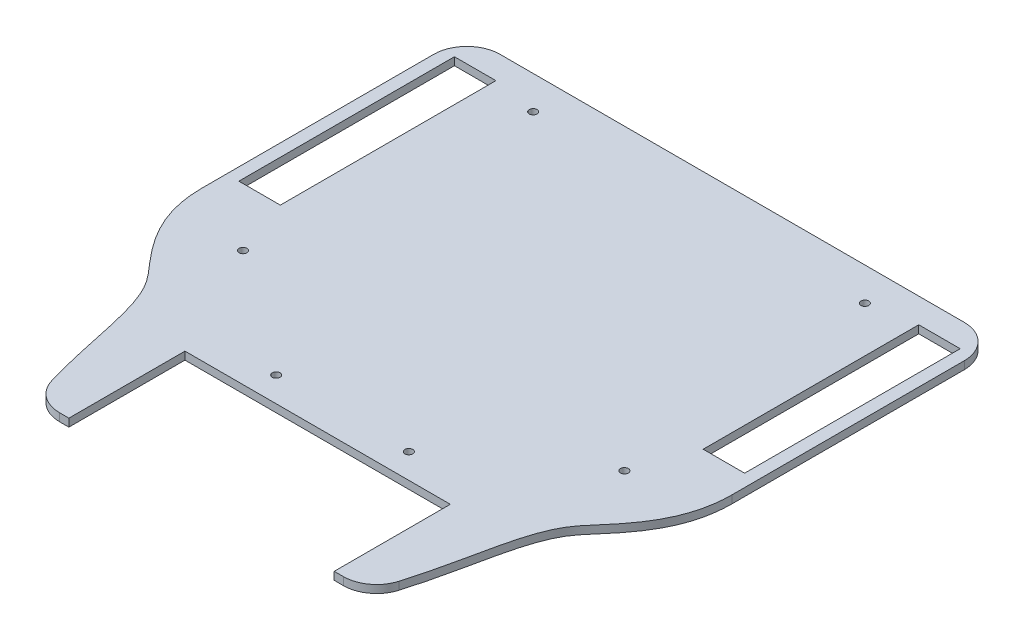
from build123d import *

# Parameters (mm, degrees)
BOSS_EXTRUDE1_DEPTH = 1.5
SKETCH3_R           = 1.5
SKETCH3_W           = 15.875
SKETCH3_H           = 82.55
CUT_EXTRUDE1_DEPTH  = 144.715413374
FILLET1_R           = 12.7


with BuildPart() as part:
    # Sketch1 → Boss-Extrude1 (new, symmetric)
    with BuildSketch(Plane(origin=(0, 0, 0), x_dir=(1, 0, 0), z_dir=(0, 1, 0))):
        with BuildLine():
            Line((-101.6, 0), (-101.6, 101.6))
            Line((-101.6, 101.6), (101.6, 101.6))
            Line((101.6, 101.6), (101.6, 0))
            add(Edge.make_bspline(
                [(101.6, 0), (101.6, -15.24), (92.836364207, -28.257655975), (72.917051275, -49.879895788), (72.621677222, -76.538397804), (63.5, -101.6)],
                knots=[0, 0, 0, 0, 0.415380003, 0.515380003, 1, 1, 1, 1], degree=3))
            Line((63.5, -101.6), (50.8, -101.6))
            Line((50.8, -101.6), (50.8, -57.15))
            Line((50.8, -57.15), (-50.8, -57.15))
            Line((-50.8, -57.15), (-50.8, -101.6))
            Line((-50.8, -101.6), (-63.5, -101.6))
            add(Edge.make_bspline(
                [(-101.6, 0), (-101.6, -15.24), (-92.836364207, -28.257655975), (-72.917051275, -49.879895788), (-72.621677222, -76.538397804), (-63.5, -101.6)],
                knots=[0, 0, 0, 0, 0.415380003, 0.515380003, 1, 1, 1, 1], degree=3))
        make_face()
    extrude(amount=BOSS_EXTRUDE1_DEPTH, both=True)

    # Sketch3 → Cut-Extrude1 (cut, through all)
    with BuildSketch(Plane(origin=(0, 1.5, 0), x_dir=(1, 0, 0), z_dir=(0, 1, 0))):
        with Locations((-63.499999999, 88.9)):
            Circle(SKETCH3_R)
        with Locations((-73.024999999, -12.7)):
            Circle(SKETCH3_R)
        with Locations((-25.399999999, -47.625)):
            Circle(SKETCH3_R)
        with Locations((25.399999999, -47.625)):
            Circle(SKETCH3_R)
        with Locations((73.024999999, -12.7)):
            Circle(SKETCH3_R)
        with Locations((63.499999999, 88.9)):
            Circle(SKETCH3_R)
        with Locations((-88.9, 50.8)):
            Rectangle(SKETCH3_W, SKETCH3_H)
        with Locations((88.9, 50.8)):
            Rectangle(SKETCH3_W, SKETCH3_H)
    extrude(amount=-CUT_EXTRUDE1_DEPTH, mode=Mode.SUBTRACT)

    # Fillet1
    fillet1_edges = [part.edges().sort_by_distance(p)[0] for p in [
        (101.6, 0, -101.6),
        (-101.6, 0, -101.6),
        (-63.5, -0.75, 101.6),
        (63.5, -0.75, 101.6),
    ]]
    fillet(fillet1_edges, radius=FILLET1_R)


solid = part.part
